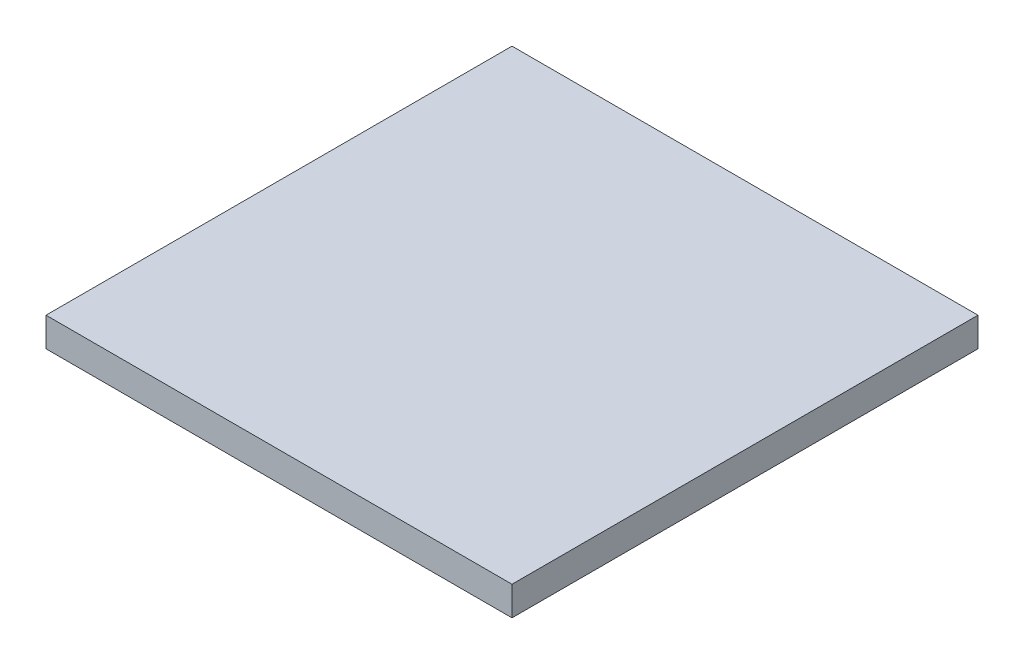
from build123d import *

# Parameters (mm, degrees)
SKETCH1_W           = 304.8
SKETCH1_H           = 304.8
BOSS_EXTRUDE1_DEPTH = 19.05


with BuildPart() as part:
    # Sketch1 → Boss-Extrude1 (new body)
    with BuildSketch(Plane(origin=(0, 0, 0), x_dir=(1, 0, 0), z_dir=(0, 1, 0))):
        with Locations((152.4, 152.4)):
            Rectangle(SKETCH1_W, SKETCH1_H)
    extrude(amount=BOSS_EXTRUDE1_DEPTH)


solid = part.part
